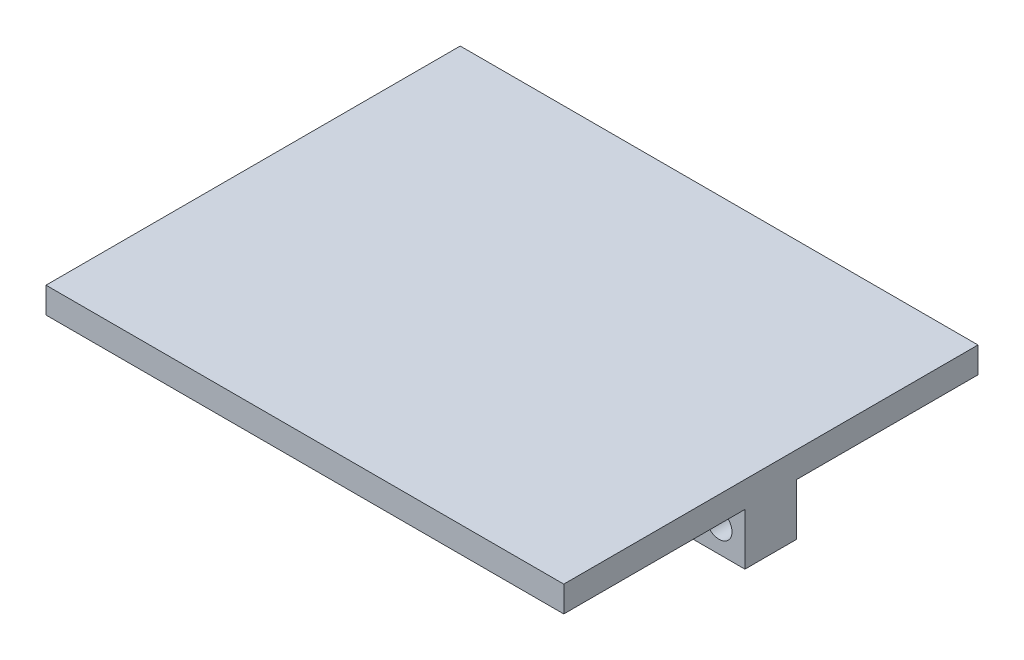
from build123d import *

# Parameters (mm, degrees)
SKETCH1_W           = 100
SKETCH1_H           = 80
BOSS_EXTRUDE1_DEPTH = 2.5
SKETCH3_W           = 10
SKETCH3_H           = 10
BOSS_EXTRUDE2_DEPTH = 10
SKETCH6_R           = 2.5
CUT_EXTRUDE2_DEPTH  = 10


with BuildPart() as part:
    # Sketch1 → Boss-Extrude1 (new, symmetric)
    with BuildSketch(Plane(origin=(0, 0, 0), x_dir=(1, 0, 0), z_dir=(0, 1, 0))):
        Rectangle(SKETCH1_W, SKETCH1_H)
    extrude(amount=BOSS_EXTRUDE1_DEPTH, both=True)

    # Sketch3 → Boss-Extrude2 (add)
    with BuildSketch(Plane.XZ.offset(2.5)):
        with Locations((-45, 0.013089728)):
            Rectangle(SKETCH3_W, SKETCH3_H)
        with Locations((45, 0.013089728)):
            Rectangle(SKETCH3_W, SKETCH3_H)
    extrude(amount=BOSS_EXTRUDE2_DEPTH)

    # Sketch6 → Cut-Extrude2 (cut)
    with BuildSketch(Plane.XY.offset(5.013089728)):
        with Locations((-45, -7.5)):
            Circle(SKETCH6_R)
        with Locations((45, -7.5)):
            Circle(SKETCH6_R)
    extrude(amount=-CUT_EXTRUDE2_DEPTH, mode=Mode.SUBTRACT)


solid = part.part
